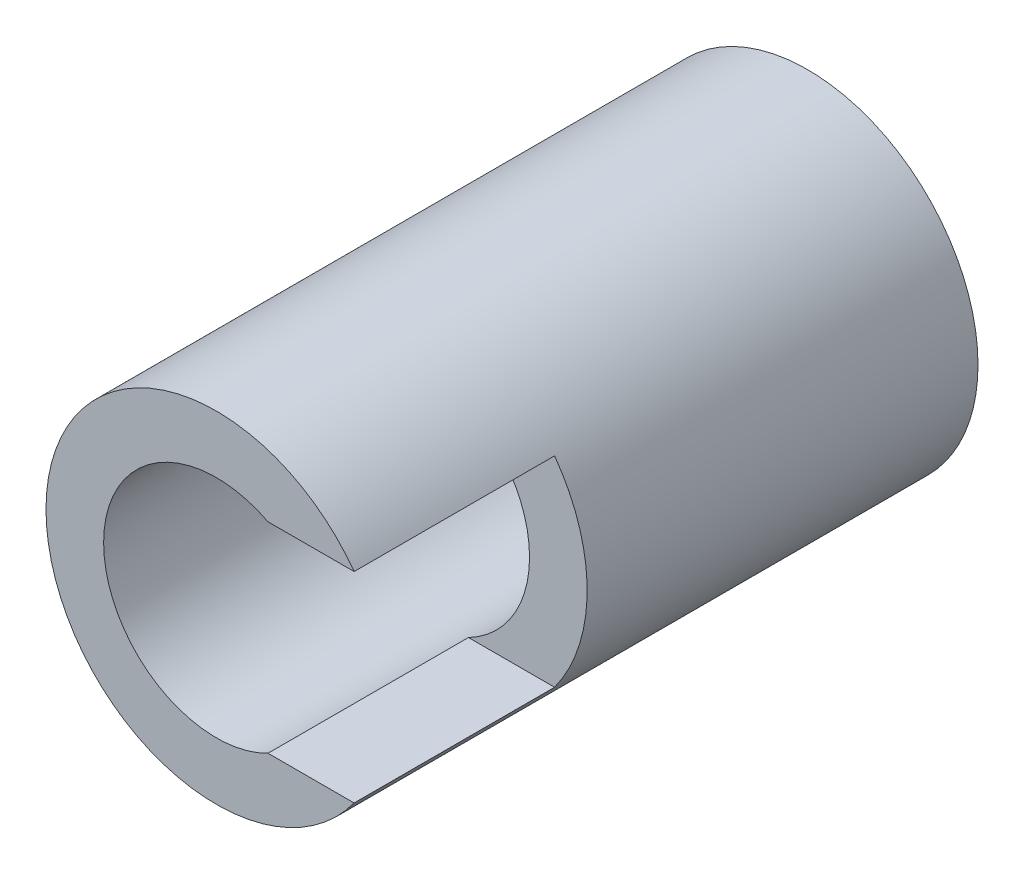
from build123d import *

# Parameters (mm, degrees)
SKETCH_1_R          = 3.4
SKETCH_1_R_2        = 2.25
EXTRUDE_1_DEPTH     = 11.8
SKETCH_2_W          = 7.078995433
SKETCH_2_H          = 4
CUT_EXTRUDE_1_DEPTH = 4


with BuildPart() as part:
    # 草图1 → 凸台-拉伸1 (new body)
    with BuildSketch(Plane.XY):
        Circle(SKETCH_1_R)
        Circle(SKETCH_1_R_2, mode=Mode.SUBTRACT)
    extrude(amount=EXTRUDE_1_DEPTH)

    # 草图2 → 切除-拉伸1 (cut)
    with BuildSketch(Plane.XY.offset(11.8)):
        with Locations((2.623845047, 0)):
            Rectangle(SKETCH_2_W, SKETCH_2_H)
    extrude(amount=-CUT_EXTRUDE_1_DEPTH, mode=Mode.SUBTRACT)


solid = part.part
